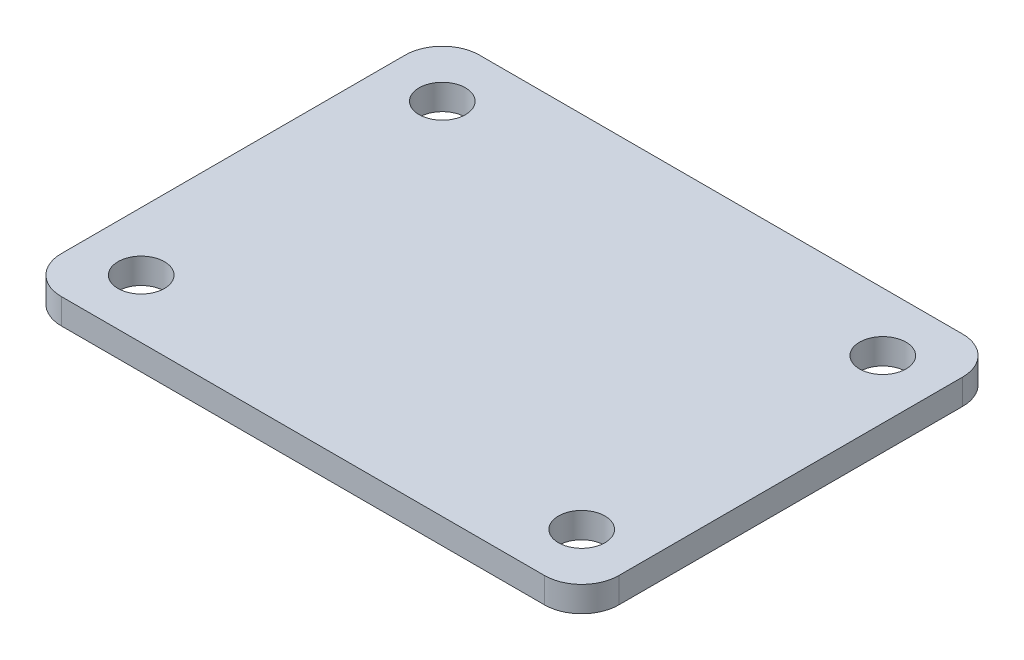
from build123d import *

# Parameters (mm, degrees)
SKETCH1_W           = 38.1
SKETCH1_H           = 28.575
BOSS_EXTRUDE1_DEPTH = 1.7399
SKETCH2_R           = 1.5875
CUT_EXTRUDE1_DEPTH  = 1.7399
FILLET1_R           = 2.54


with BuildPart() as part:
    # Sketch1 → Boss-Extrude1 (new body)
    with BuildSketch(Plane(origin=(0, 0, 0), x_dir=(1, 0, 0), z_dir=(0, 1, 0))):
        with Locations((19.05, 14.2875)):
            Rectangle(SKETCH1_W, SKETCH1_H)
    extrude(amount=BOSS_EXTRUDE1_DEPTH)

    # Sketch2 → Cut-Extrude1 (cut)
    with BuildSketch(Plane(origin=(0, 1.7399, 0), x_dir=(1, 0, 0), z_dir=(0, 1, 0))):
        with Locations((4.0005, 4.0005)):
            Circle(SKETCH2_R)
        with Locations((34.0995, 4.0005)):
            Circle(SKETCH2_R)
        with Locations((4.0005, 24.5745)):
            Circle(SKETCH2_R)
        with Locations((34.0995, 24.5745)):
            Circle(SKETCH2_R)
    extrude(amount=-CUT_EXTRUDE1_DEPTH, mode=Mode.SUBTRACT)

    # Fillet1
    fillet1_edges = [part.edges().sort_by_distance(p)[0] for p in [
        (38.1, 0.86995, -28.575),
        (38.1, 0.86995, 0),
        (0, 0.86995, 0),
        (0, 0.86995, -28.575),
    ]]
    fillet(fillet1_edges, radius=FILLET1_R)


solid = part.part
